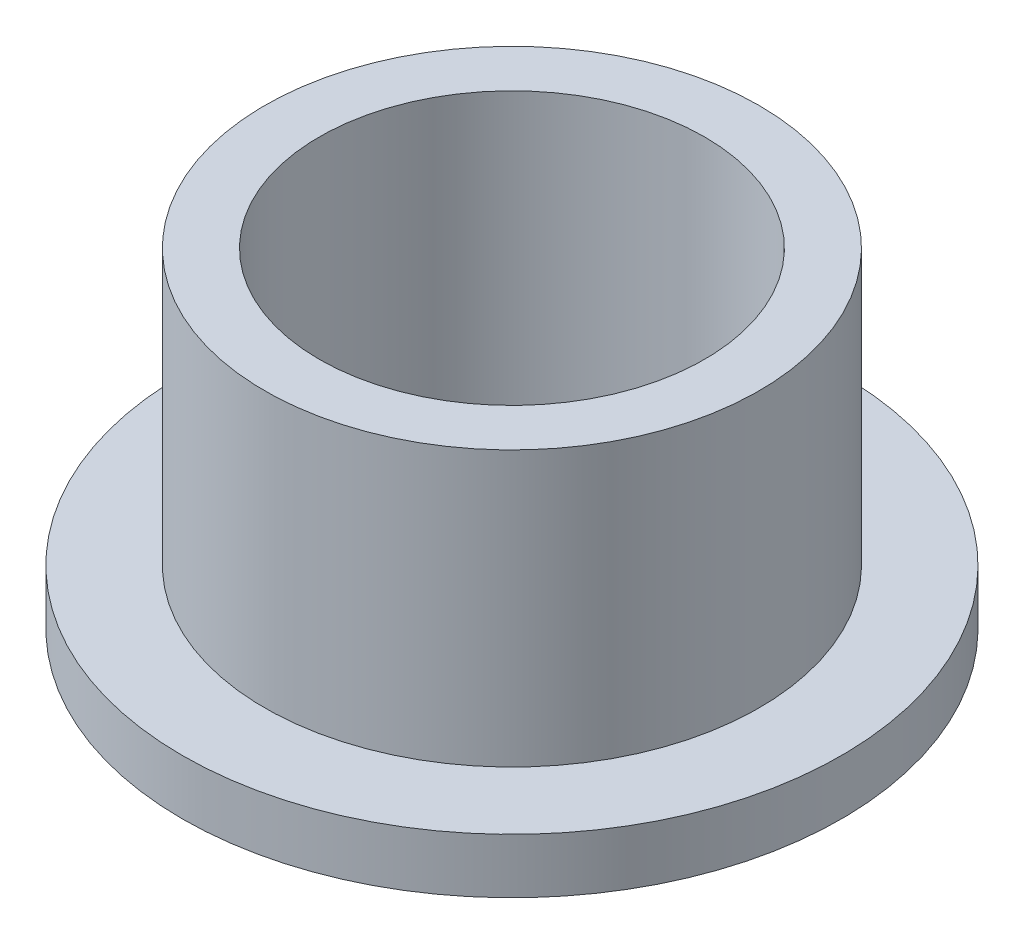
from build123d import *

# Parameters (mm, degrees)
SKETCH2_R           = 14.2875
SKETCH2_R_2         = 11.1379
BOSS_EXTRUDE1_DEPTH = 19.05
SKETCH3_R           = 19.05
SKETCH3_R_2         = 14.2875
BOSS_EXTRUDE2_DEPTH = 3.175


with BuildPart() as part:
    # Sketch2 → Boss-Extrude1 (new body)
    with BuildSketch(Plane(origin=(0, 0, 0), x_dir=(1, 0, 0), z_dir=(0, 1, 0))):
        with Locations(Location((0, 0, 0), (0, 0, 90))):
            Circle(SKETCH2_R)
        with Locations(Location((0, 0, 0), (0, 0, 90))):
            Circle(SKETCH2_R_2, mode=Mode.SUBTRACT)
    extrude(amount=BOSS_EXTRUDE1_DEPTH)

    # Sketch3 → Boss-Extrude2 (add)
    with BuildSketch(Plane(origin=(0, 0, 0), x_dir=(1, 0, 0), z_dir=(0, 1, 0))):
        with Locations(Location((0, 0, 0), (0, 0, 270))):
            Circle(SKETCH3_R)
        with Locations(Location((0, 0, 0), (0, 0, 90))):
            Circle(SKETCH3_R_2, mode=Mode.SUBTRACT)
    extrude(amount=BOSS_EXTRUDE2_DEPTH)


solid = part.part
